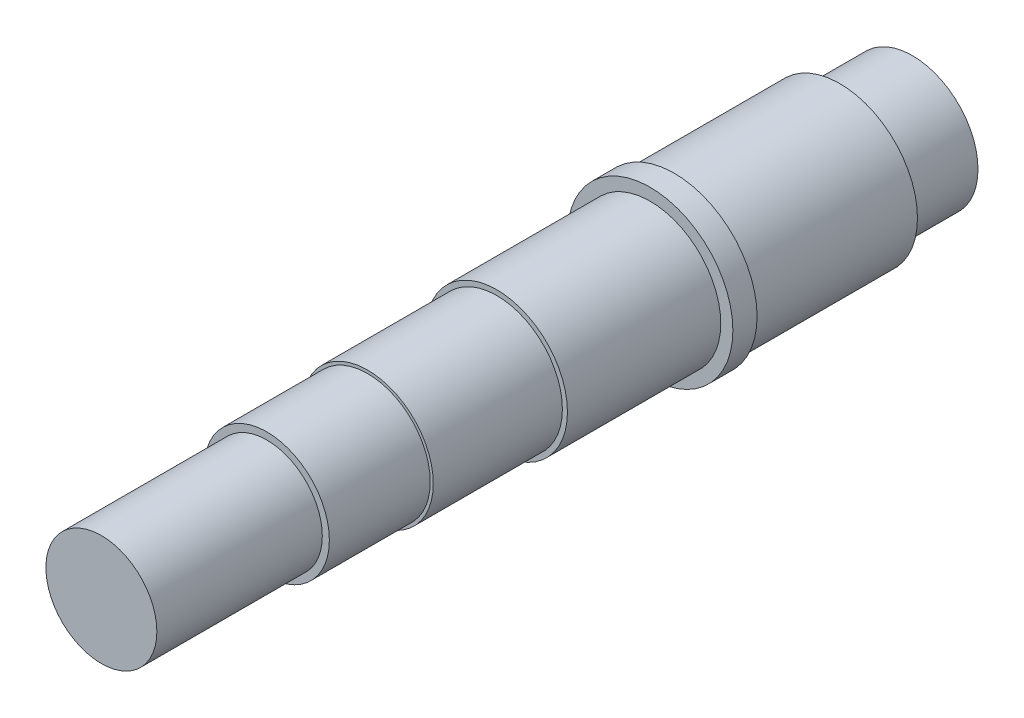
from build123d import *

# Parameters (mm, degrees)
SKETCH_1_R      = 32.5
EXTRUDE_1_DEPTH = 36
SKETCH_2_R      = 38.5
EXTRUDE_2_DEPTH = 82
SKETCH_3_R      = 41
EXTRUDE_3_DEPTH = 12
SKETCH_4_R      = 35
EXTRUDE_4_DEPTH = 76
SKETCH_5_R      = 32.5
EXTRUDE_5_DEPTH = 64
SKETCH_6_R      = 31
EXTRUDE_6_DEPTH = 50
SKETCH_7_R      = 27.5
EXTRUDE_7_DEPTH = 82


with BuildPart() as part:
    # 草图1 → 凸台-拉伸1 (new body)
    with BuildSketch(Plane.XY):
        Circle(SKETCH_1_R)
    extrude(amount=EXTRUDE_1_DEPTH)

    # 草图2 → 凸台-拉伸2 (add)
    with BuildSketch(Plane.XY.offset(36)):
        Circle(SKETCH_2_R)
    extrude(amount=EXTRUDE_2_DEPTH)

    # 草图3 → 凸台-拉伸3 (add)
    with BuildSketch(Plane.XY.offset(118)):
        Circle(SKETCH_3_R)
    extrude(amount=EXTRUDE_3_DEPTH)

    # 草图4 → 凸台-拉伸4 (add)
    with BuildSketch(Plane.XY.offset(130)):
        Circle(SKETCH_4_R)
    extrude(amount=EXTRUDE_4_DEPTH)

    # 草图5 → 凸台-拉伸5 (add)
    with BuildSketch(Plane.XY.offset(206)):
        Circle(SKETCH_5_R)
    extrude(amount=EXTRUDE_5_DEPTH)

    # 草图6 → 凸台-拉伸6 (add)
    with BuildSketch(Plane.XY.offset(270)):
        Circle(SKETCH_6_R)
    extrude(amount=EXTRUDE_6_DEPTH)

    # 草图7 → 凸台-拉伸7 (add)
    with BuildSketch(Plane.XY.offset(320)):
        Circle(SKETCH_7_R)
    extrude(amount=EXTRUDE_7_DEPTH)


solid = part.part
